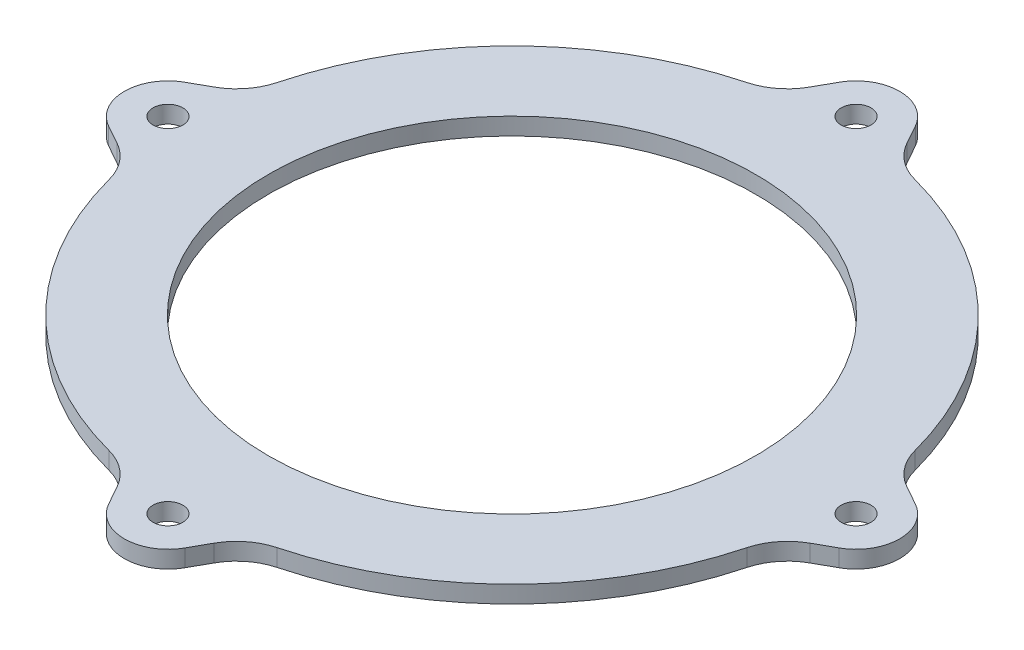
from build123d import *

# Parameters (mm, degrees)
SKETCH_1_R      = 42.5
SKETCH_1_R_2    = 2.6
EXTRUDE_1_DEPTH = 3
FILLET_1_R      = 10


with BuildPart() as part:
    # ｽｹｯﾁ1 → ﾎﾞｽ - 押し出し1 (new body)
    with BuildSketch(Plane(origin=(0, 0, 0), x_dir=(1, 0, 0), z_dir=(0, 1, 0))):
        with BuildLine():
            Line((-6.641105235, 63.695364835), (-10.641105235, 56.506786136))
            ThreePointArc((-10.641105235, 56.506786136), (-40.658639918, 40.658639918), (-56.506786136, 10.641105235))
            Line((-56.506786136, 10.641105235), (-63.695364835, 6.641105235))
            ThreePointArc((-63.695364835, 6.641105235), (-67.6, 0), (-63.695364835, -6.641105235))
            Line((-63.695364835, -6.641105235), (-56.506786136, -10.641105235))
            ThreePointArc((-56.506786136, -10.641105235), (-40.658639918, -40.658639918), (-10.641105235, -56.506786136))
            Line((-10.641105235, -56.506786136), (-6.641105235, -63.695364835))
            ThreePointArc((-6.641105235, -63.695364835), (0, -67.6), (6.641105235, -63.695364835))
            Line((6.641105235, -63.695364835), (10.641105235, -56.506786136))
            ThreePointArc((10.641105235, -56.506786136), (40.658639918, -40.658639918), (56.506786136, -10.641105235))
            Line((56.506786136, -10.641105235), (63.695364835, -6.641105235))
            ThreePointArc((63.695364835, -6.641105235), (67.6, 0), (63.695364835, 6.641105235))
            Line((63.695364835, 6.641105235), (56.506786136, 10.641105235))
            ThreePointArc((56.506786136, 10.641105235), (40.658639918, 40.658639918), (10.641105235, 56.506786136))
            Line((10.641105235, 56.506786136), (6.641105235, 63.695364835))
            ThreePointArc((6.641105235, 63.695364835), (0, 67.6), (-6.641105235, 63.695364835))
        make_face()
        with Locations(Location((0, 0, 0), (0, 0, 270))):
            Circle(SKETCH_1_R, mode=Mode.SUBTRACT)
        with Locations(Location((0, 60, 0), (0, 0, 270))):
            Circle(SKETCH_1_R_2, mode=Mode.SUBTRACT)
        with Locations(Location((60, 0, 0), (0, 0, 270))):
            Circle(SKETCH_1_R_2, mode=Mode.SUBTRACT)
        with Locations(Location((0, -60, 0), (0, 0, 270))):
            Circle(SKETCH_1_R_2, mode=Mode.SUBTRACT)
        with Locations(Location((-60, 0, 0), (0, 0, 270))):
            Circle(SKETCH_1_R_2, mode=Mode.SUBTRACT)
    extrude(amount=EXTRUDE_1_DEPTH)

    # ﾌｨﾚｯﾄ1
    fillet_1_edges = [part.edges().sort_by_distance(p)[0] for p in [
        (10.641105235, 1.5, -56.506786136),
        (56.506786136, 1.5, -10.641105235),
        (56.506786136, 1.5, 10.641105235),
        (10.641105235, 1.5, 56.506786136),
        (-10.641105235, 1.5, 56.506786136),
        (-56.506786136, 1.5, 10.641105235),
        (-56.506786136, 1.5, -10.641105235),
        (-10.641105235, 1.5, -56.506786136),
    ]]
    fillet(fillet_1_edges, radius=FILLET_1_R)


solid = part.part
